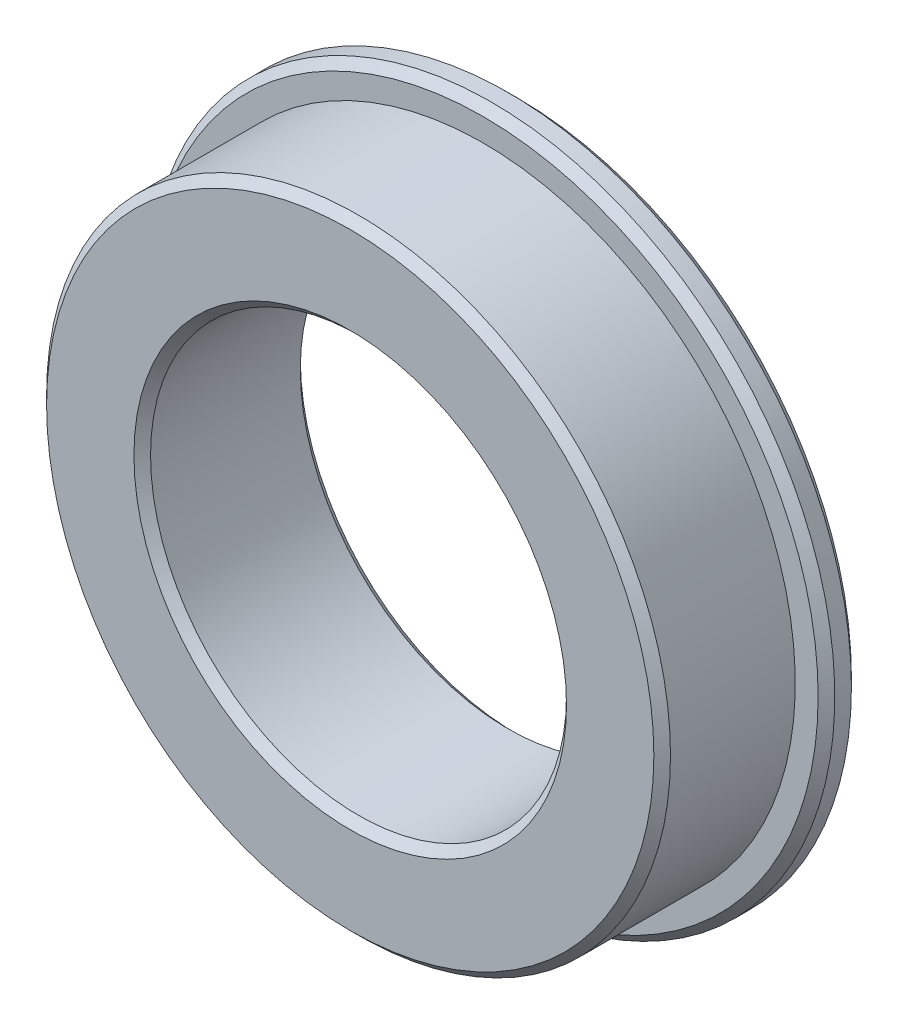
from build123d import *

# Parameters (mm, degrees)
SKETCH_1_R      = 7.5
SKETCH_1_R_2    = 5
EXTRUDE_1_DEPTH = 4
SKETCH_2_R      = 8.25
SKETCH_2_R_2    = 7.5
EXTRUDE_2_DEPTH = 0.8
CHAMFER_1_SIZE  = 0.2


with BuildPart() as part:
    # 草图1 → 凸台-拉伸1 (new body)
    with BuildSketch(Plane.XY):
        Circle(SKETCH_1_R)
        Circle(SKETCH_1_R_2, mode=Mode.SUBTRACT)
    extrude(amount=EXTRUDE_1_DEPTH)

    # 草图2 → 凸台-拉伸2 (add)
    with BuildSketch(Plane(origin=(0, 0, 0), x_dir=(-1, 0, 0), z_dir=(0, 0, -1))):
        Circle(SKETCH_2_R)
        Circle(SKETCH_2_R_2, mode=Mode.SUBTRACT)
    extrude(amount=-EXTRUDE_2_DEPTH)

    # 倒角1
    chamfer_1_edges = [part.edges().sort_by_distance(p)[0] for p in [
        (8.25, 0, 0.8),
        (8.25, 0, 0),
        (-7.5, 0, 4),
        (-5, 0, 0),
        (-5, 0, 4),
    ]]
    chamfer(chamfer_1_edges, length=CHAMFER_1_SIZE)


solid = part.part
